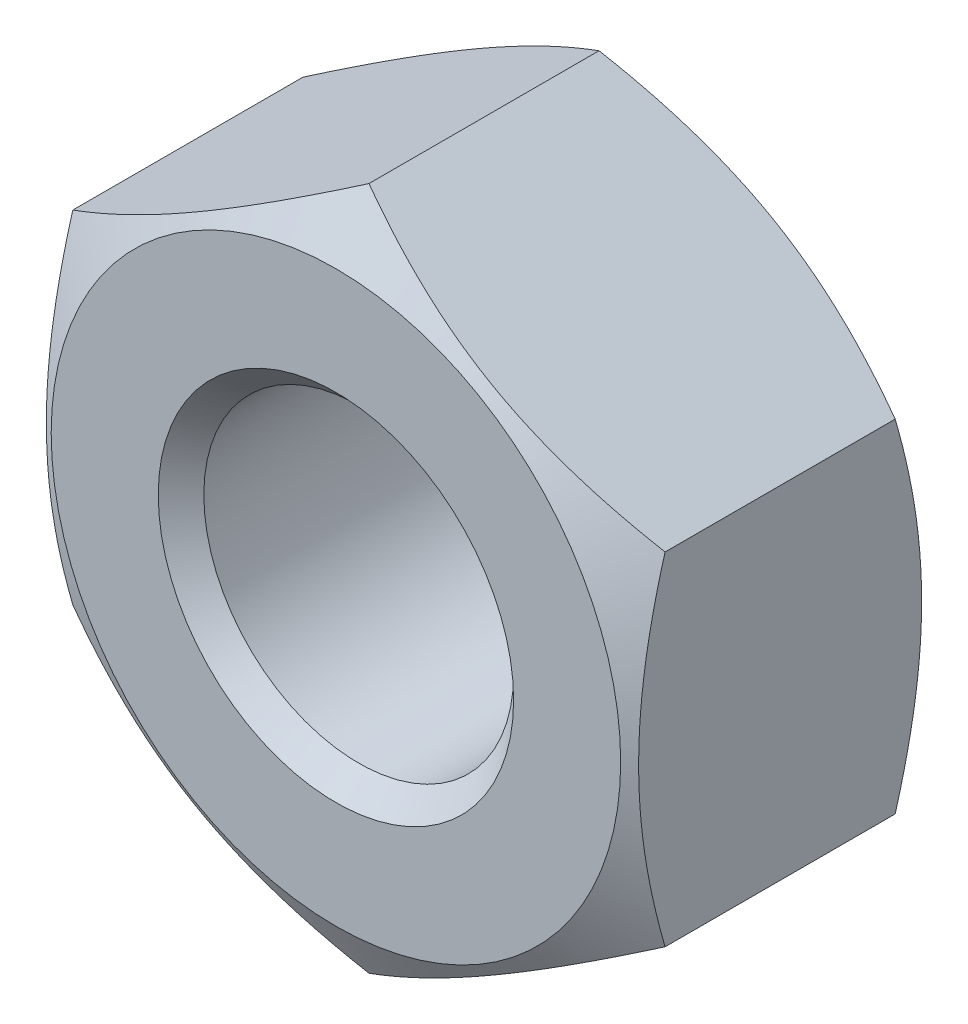
from build123d import *

# Parameters (mm, degrees)
SKETCH2_R              = 8
CUT_EXTRUDE1_DEPTH     = 14.047988351
M8X1_25_TAPPED_HOLE1_D = 6.8
CHAMFER1_SIZE          = 0.5


with BuildPart() as part:
    # Sketch1 → Revolve1 (revolve)
    with BuildSketch(Plane(origin=(0, 0, 0), x_dir=(0, 0, -1), z_dir=(1, 0, 0)), mode=Mode.PRIVATE) as revolve1_sk:
        Polygon((0, 6.25), (1.010362971, 8), (5.489637029, 8), (6.5, 6.25), (6.5, 0), (0, 0), align=None)
    revolve(revolve1_sk.sketch.rotate(Axis((0, 0, 0), (0, 0, -1)), 90), axis=Axis((0, 0, 0), (0, 0, -1)))

    # Sketch2 → Cut-Extrude1 (cut, through all)
    with BuildSketch(Plane.XY):
        Circle(SKETCH2_R)
        Polygon((0, 7.505553499), (-6.5, 3.75277675), (-6.5, -3.75277675), (0, -7.505553499), (6.5, -3.75277675), (6.5, 3.75277675), align=None, mode=Mode.SUBTRACT)
    extrude(amount=-CUT_EXTRUDE1_DEPTH, mode=Mode.SUBTRACT)

    # M8x1.25 Tapped Hole1 (through all)
    with Locations(Plane.XY):
        with Locations((0, 0)):
            Hole(M8X1_25_TAPPED_HOLE1_D / 2)

    # Chamfer1
    chamfer1_edges = [part.edges().sort_by_distance(p)[0] for p in [
        (3.4, 0, 0),
        (3.4, 0, -6.5),
    ]]
    chamfer(chamfer1_edges, length=CHAMFER1_SIZE)


solid = part.part
